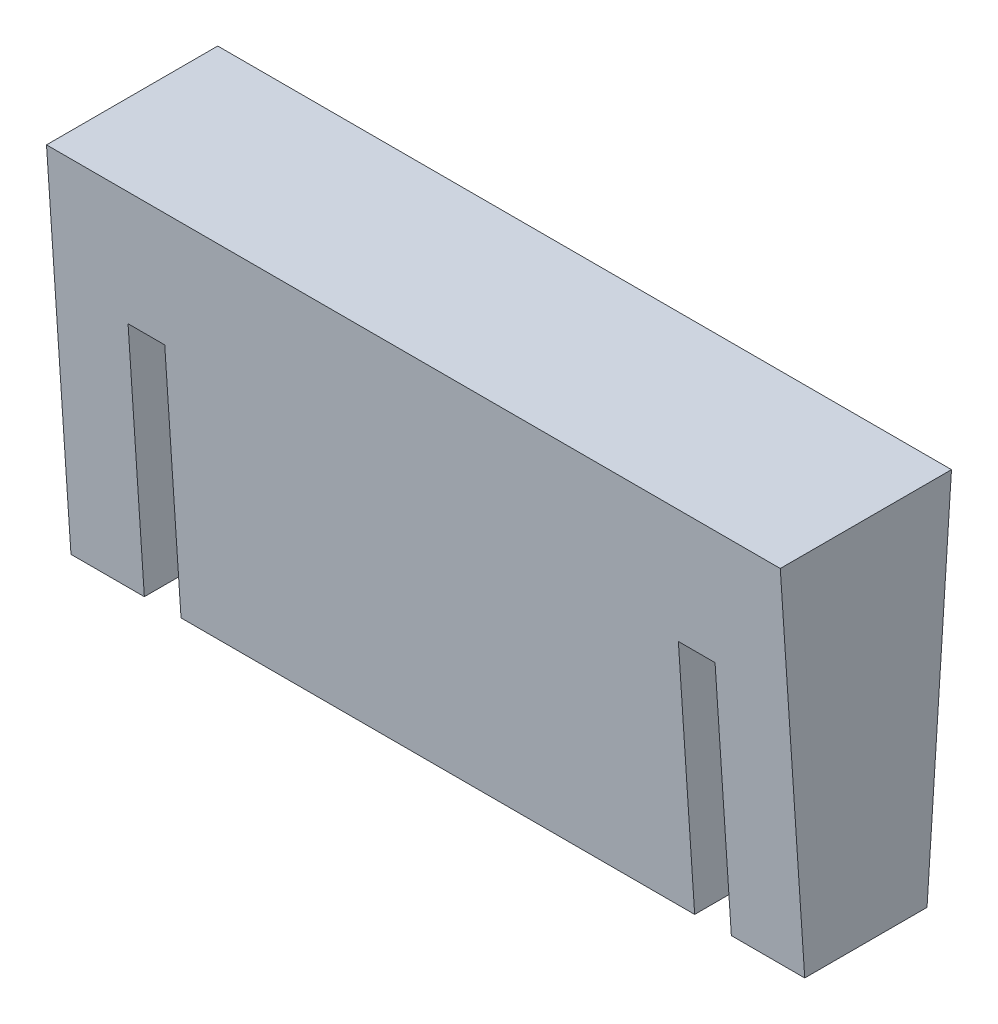
from build123d import *

# Parameters (mm, degrees)
SKETCH1_W           = 60
SKETCH1_H           = 14
BOSS_EXTRUDE1_DEPTH = 30
SKETCH2_W           = 3
SKETCH2_H           = 20
CUT_EXTRUDE1_DEPTH  = 45.676615807
CUT_EXTRUDE2_DEPTH  = 68.446274916


with BuildPart() as part:
    # Sketch1 → Boss-Extrude1 (new body)
    with BuildSketch(Plane(origin=(0, 0, 0), x_dir=(1, 0, 0), z_dir=(0, 1, 0))):
        Rectangle(SKETCH1_W, SKETCH1_H)
    extrude(amount=BOSS_EXTRUDE1_DEPTH)

    # Sketch2 → Cut-Extrude1 (cut, through all)
    with BuildSketch(Plane.XY.offset(7)):
        with Locations((-22.5, 10)):
            Rectangle(SKETCH2_W, SKETCH2_H)
        with Locations((22.5, 10)):
            Rectangle(SKETCH2_W, SKETCH2_H)
    extrude(amount=-CUT_EXTRUDE1_DEPTH, mode=Mode.SUBTRACT)

    # Sketch3 → Cut-Extrude2 (cut, through all)
    with BuildSketch(Plane.ZY.offset(30)):
        Polygon((-7, 30), (-5, 0), (-7, 0), align=None)
        Polygon((7, 30), (5, 0), (7, 0), align=None)
    extrude(amount=-CUT_EXTRUDE2_DEPTH, mode=Mode.SUBTRACT)


solid = part.part
